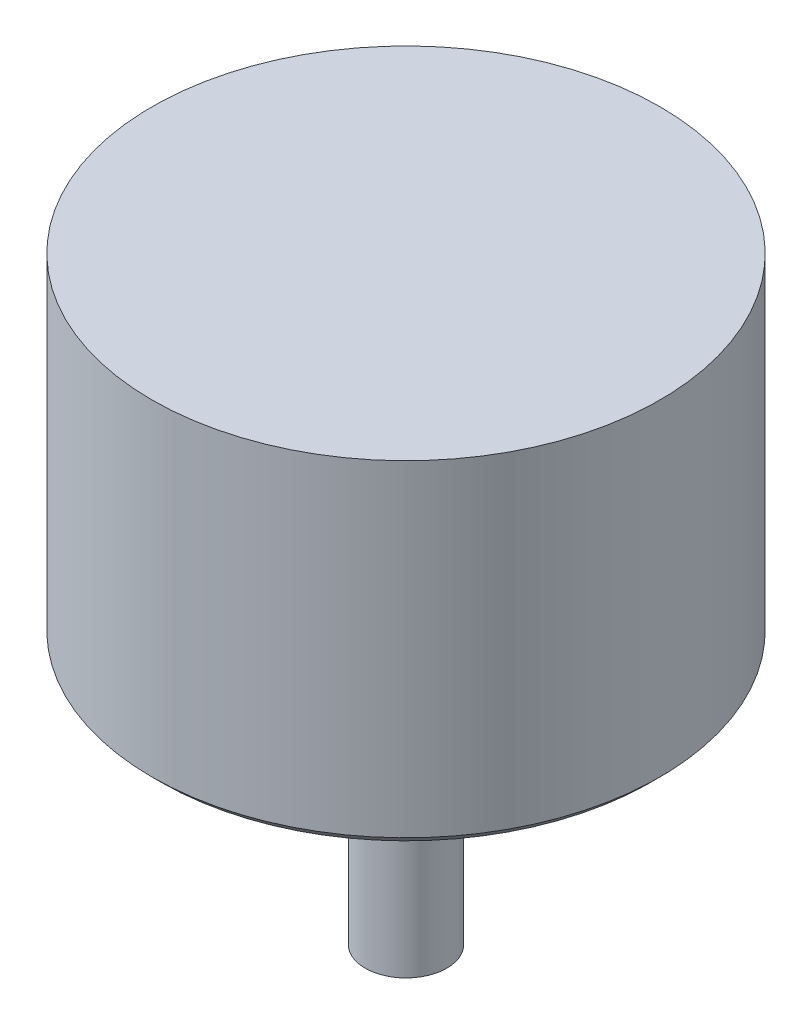
from build123d import *

# Parameters (mm, degrees)
SKETCH1_R           = 14
BOSS_EXTRUDE4_DEPTH = 19
SKETCH7_R           = 2.25
BOSS_EXTRUDE5_DEPTH = 14
SKETCH9_R           = 4
BOSS_EXTRUDE8_DEPTH = 1


with BuildPart() as part:
    # Sketch1 → Boss-Extrude4 (new body)
    with BuildSketch(Plane(origin=(0, 0, 0), x_dir=(1, 0, 0), z_dir=(0, 1, 0))):
        with Locations(Location((0, 0, 0), (0, 0, 270))):
            Circle(SKETCH1_R)
    extrude(amount=BOSS_EXTRUDE4_DEPTH)

    # Sketch7 → Boss-Extrude5 (add)
    with BuildSketch(Plane.XZ):
        with Locations(Location((0, 0, 0), (0, 0, 270))):
            Circle(SKETCH7_R)
    extrude(amount=BOSS_EXTRUDE5_DEPTH)

    # Sketch9 → Boss-Extrude8 (add)
    with BuildSketch(Plane.XZ):
        with Locations(Location((0, 0, 0), (0, 0, 90))):
            Circle(SKETCH9_R)
    extrude(amount=BOSS_EXTRUDE8_DEPTH)

    # Sketch10 → Cut-Revolve9 (revolve, cut)
    with BuildSketch(Plane.XY, mode=Mode.PRIVATE) as cut_revolve9_sk:
        Polygon((-4, 0), (-14, 0), (-14, 1.001232808), (-13.499383596, 0.500616404), align=None)
    revolve(cut_revolve9_sk.sketch.rotate(Axis((0, 0.500616404, 0), (0, 1, 0)), 90), axis=Axis((0, 0.500616404, 0), (0, 1, 0)), mode=Mode.SUBTRACT)


solid = part.part
